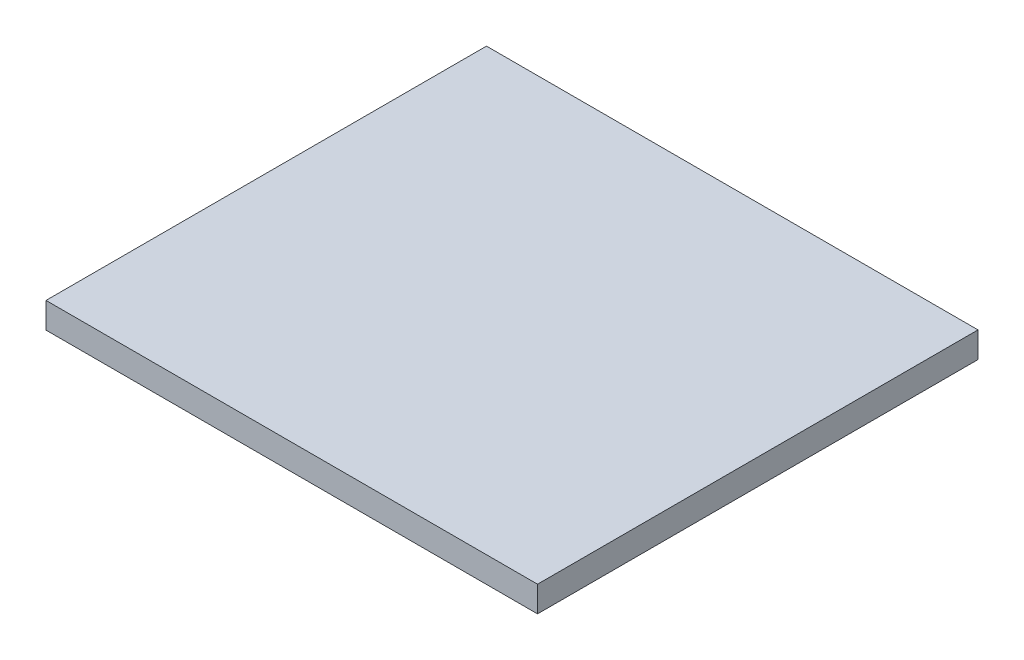
from build123d import *

# Parameters (mm, degrees)
SKETCH1_W           = 191.026260984
SKETCH1_H           = 171.189963614
BOSS_EXTRUDE1_DEPTH = 10


with BuildPart() as part:
    # Sketch1 → Boss-Extrude1 (new body)
    with BuildSketch(Plane(origin=(0, 0, 0), x_dir=(1, 0, 0), z_dir=(0, 1, 0))):
        with Locations((3.668356363, -5.57046707)):
            Rectangle(SKETCH1_W, SKETCH1_H)
    extrude(amount=BOSS_EXTRUDE1_DEPTH)


solid = part.part
